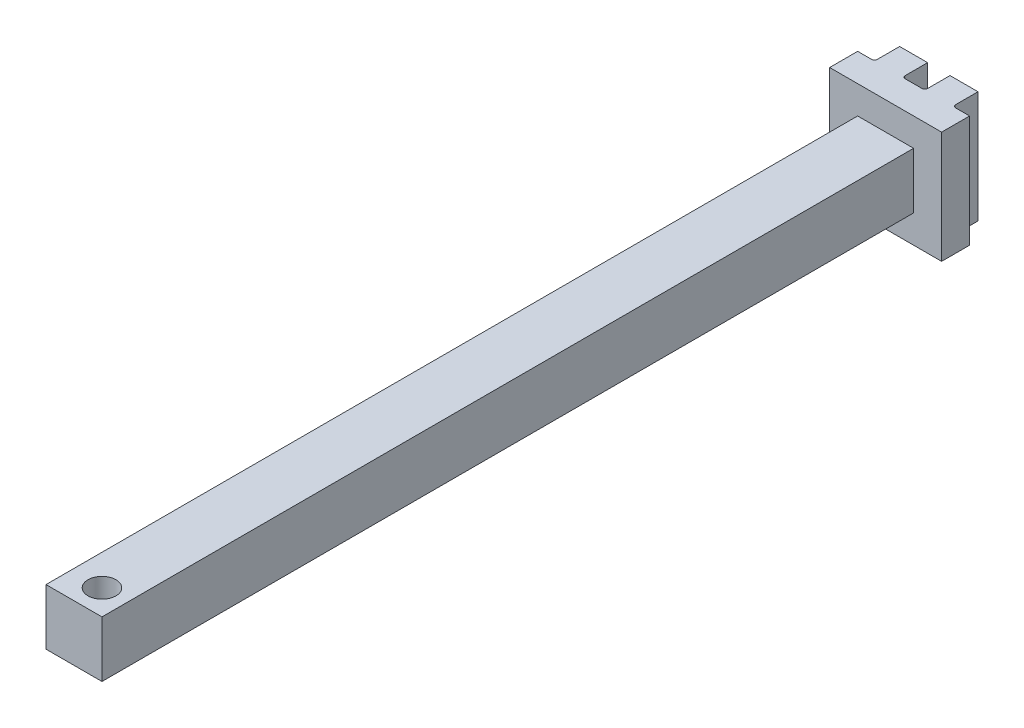
from build123d import *

# Parameters (mm, degrees)
SKETCH2_W           = 100
SKETCH2_H           = 100
BOSS_EXTRUDE1_DEPTH = 1500
CUT_EXTRUDE1_REACH  = 1508.652
SKETCH3_R           = 25
SKETCH4_W           = 200
SKETCH4_H           = 200
BOSS_EXTRUDE2_DEPTH = 50
SKETCH5_W           = 50
SKETCH5_H           = 45
BOSS_EXTRUDE3_DEPTH = 200
FILLET1_R           = 5


with BuildPart() as part:
    # Sketch2 → Boss-Extrude1 (new body)
    with BuildSketch(Plane.XY):
        with Locations((50, 50)):
            Rectangle(SKETCH2_W, SKETCH2_H)
    extrude(amount=BOSS_EXTRUDE1_DEPTH)

    # Sketch3 → Cut-Extrude1 (cut, up to next)
    with BuildSketch(Plane.XZ, mode=Mode.PRIVATE) as cut_extrude1_sk1:
        with Locations(Location((55, 1455, 0), (0, 0, 270))):
            Circle(SKETCH3_R)
    cut_extrude1_tool1 = extrude(cut_extrude1_sk1.sketch, amount=-CUT_EXTRUDE1_REACH, mode=Mode.PRIVATE) & part.part
    add(cut_extrude1_tool1.solids().sort_by_distance((55, 0, 1455))[0], mode=Mode.SUBTRACT)

    # Sketch4 → Boss-Extrude2 (add)
    with BuildSketch(Plane(origin=(0, 0, 0), x_dir=(-1, 0, 0), z_dir=(0, 0, -1))):
        with Locations((-50, 50)):
            Rectangle(SKETCH4_W, SKETCH4_H)
    extrude(amount=-BOSS_EXTRUDE2_DEPTH)

    # Sketch5 → Boss-Extrude3 (add)
    with BuildSketch(Plane.XZ.offset(50)):
        with Locations((5, -22.5)):
            Rectangle(SKETCH5_W, SKETCH5_H)
        with Locations((95, -22.5)):
            Rectangle(SKETCH5_W, SKETCH5_H)
    extrude(amount=-BOSS_EXTRUDE3_DEPTH)

    # Fillet1
    fillet1_edges = [part.edges().sort_by_distance(p)[0] for p in [
        (30, 50, 0),
        (-20, 50, 0),
        (120, 50, 0),
        (70, 50, 0),
    ]]
    fillet(fillet1_edges, radius=FILLET1_R)


solid = part.part
